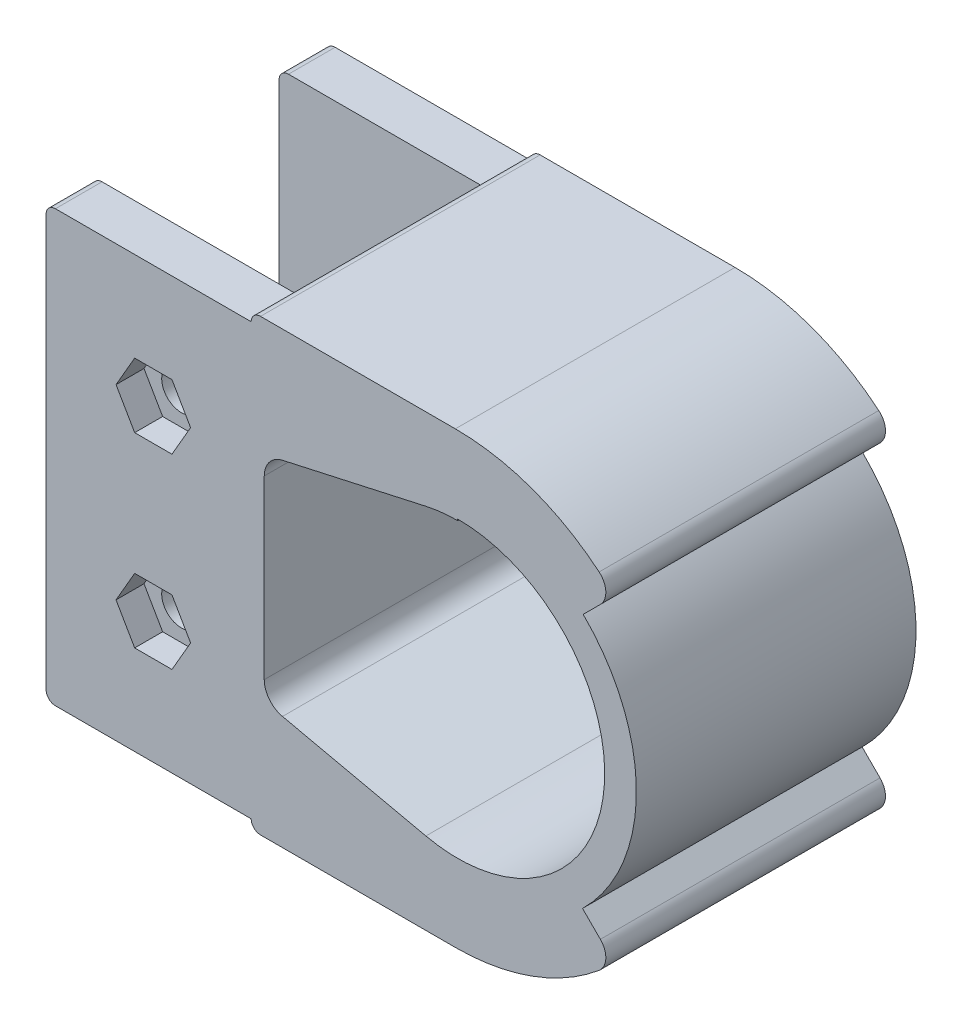
from build123d import *

# Parameters (mm, degrees)
EXTRUDE_1_DEPTH          = 30
EXTRUDE_START            = -30
EXTRUDE_2_DEPTH          = 30
EXTRUDE_3_DEPTH          = 30
EXTRUDE_START_2          = -2
SKETCH_9_W               = 5
SKETCH_9_H               = 46.18577558
EXTRUDE_6_DEPTH          = 22
FILLET_3_R               = 1
CUT_EXTRUDE_4_DEPTH      = 59.377928803
CUT_EXTRUDE_4_DEPTH_BACK = 59.377928803
SKETCH_10_R              = 2.1
CUT_EXTRUDE_5_DEPTH      = 3


with BuildPart() as part:
    # 草图1 → 凸台-拉伸1 (new body)
    with BuildSketch(Plane.XY):
        with BuildLine():
            Line((-23.903477417, 9.605041416), (-23.903477417, -9.460776308))
            ThreePointArc((-23.903477417, -9.460776308), (-22.605516257, -13.152827027), (-19.282718599, -15.22042404))
            Line((-19.282718599, -15.22042404), (-3.900036331, -18.636980321))
            ThreePointArc((-3.900036331, -18.636980321), (19.420354058, 0.072132554), (-3.900036331, 18.78124543))
            Line((-3.900036331, 18.78124543), (-19.282718599, 15.364689149))
            ThreePointArc((-19.282718599, 15.364689149), (-22.605516257, 13.297092136), (-23.903477417, 9.605041416))
        make_face()
        with BuildLine():
            ThreePointArc((-20.503477417, -9.460776308), (-19.953493875, -11.025204579), (-18.545528765, -11.901305008))
            Line((-18.545528765, -11.901305008), (-3.162846498, -15.317861289))
            ThreePointArc((-3.162846498, -15.317861289), (16.020354058, 0.072132554), (-3.162846498, 15.462126398))
            Line((-3.162846498, 15.462126398), (-18.545528765, 12.045570117))
            ThreePointArc((-18.545528765, 12.045570117), (-19.953493875, 11.169469687), (-20.503477417, 9.605041416))
            Line((-20.503477417, 9.605041416), (-20.503477417, -9.460776308))
        make_face(mode=Mode.SUBTRACT)
    extrude(amount=EXTRUDE_1_DEPTH)

    # 草图2 → 凸台-拉伸2 (add)
    with BuildSketch(Plane.XY.offset(30).offset(EXTRUDE_START)):
        with BuildLine():
            Line((0.255333714, -19.09288779), (-21.903477417, -19.09288779))
            ThreePointArc((-21.903477417, -19.09288779), (-23.31769098, -18.507101352), (-23.903477417, -17.09288779))
            Line((-23.903477417, -17.09288779), (-23.903477417, -9.460776308))
            Line((-23.903477417, -9.460776308), (-20.503477417, -9.460776308))
            ThreePointArc((-20.503477417, -9.460776308), (-19.953493875, -11.025204579), (-18.545528765, -11.901305008))
            Line((-18.545528765, -11.901305008), (-3.162846498, -15.317861289))
            ThreePointArc((-3.162846498, -15.317861289), (-1.464012153, -15.598850703), (0.255333714, -15.69288779))
            Line((0.255333714, -15.69288779), (0.255333714, -19.09288779))
        make_face()
    extrude_2 = extrude(amount=EXTRUDE_2_DEPTH)

    # 草图3 → 凸台-拉伸3 (add)
    with BuildSketch(Plane(origin=(0, 0, 0), x_dir=(-1, 0, 0), z_dir=(0, 0, -1))):
        with BuildLine():
            Line((21.903477417, -19.09288779), (21.903477417, -23.09288779))
            ThreePointArc((21.903477417, -23.09288779), (21.610584198, -23.799994571), (20.903477417, -24.09288779))
            Line((20.903477417, -24.09288779), (0, -24.09288779))
            ThreePointArc((0, -24.09288779), (-8.201928623, -22.653821067), (-15.42405585, -18.508531632))
            ThreePointArc((-15.42405585, -18.508531632), (-16.141619311, -17.062720423), (-15.557886921, -15.557886921))
            Line((-15.557886921, -15.557886921), (-13.642327271, -13.642327271))
            ThreePointArc((-13.642327271, -13.642327271), (-7.482369871, -17.678021056), (-0.255333714, -19.09288779))
            Line((-0.255333714, -19.09288779), (21.903477417, -19.09288779))
        make_face()
    extrude_3 = extrude(amount=-EXTRUDE_3_DEPTH)

    # 镜向1: 凸台-拉伸2, 凸台-拉伸3 across plane
    add(extrude_2.mirror(Plane.ZX))
    add(extrude_3.mirror(Plane.ZX))

    # 草图9 → 凸台-拉伸6 (add)
    with BuildSketch(Plane.ZY.offset(23.903477417).offset(EXTRUDE_START_2)):
        with Locations((2.5, 0)):
            Rectangle(SKETCH_9_W, SKETCH_9_H)
        with Locations((27.5, 0)):
            Rectangle(SKETCH_9_W, SKETCH_9_H)
    extrude(amount=EXTRUDE_6_DEPTH)

    # 圆角3
    fillet_3_edges = [part.edges().sort_by_distance(p)[0] for p in [
        (-43.903477417, 23.09288779, 27.5),
        (-43.903477417, -23.09288779, 27.5),
        (-43.903477417, 23.09288779, 2.5),
        (-43.903477417, -23.09288779, 2.5),
    ]]
    fillet(fillet_3_edges, radius=FILLET_3_R)

    # 草图10 → 切除-拉伸4 (cut, two sides: drawn at the far end of the back side and taken through both)
    with BuildSketch(Plane.XY.offset(30).offset(-CUT_EXTRUDE_4_DEPTH_BACK)):
        with Locations((-32.403477417, 10)):
            Circle(SKETCH_10_R)
        with Locations((-32.403477417, -10)):
            Circle(SKETCH_10_R)
    extrude(amount=CUT_EXTRUDE_4_DEPTH + CUT_EXTRUDE_4_DEPTH_BACK, mode=Mode.SUBTRACT)

    # 草图11 → 切除-拉伸5 (cut)
    with BuildSketch(Plane.XY.offset(30)):
        Polygon((-28.403477417, -10), (-30.403477417, -6.535898385), (-34.403477417, -6.535898385), (-36.403477417, -10), (-34.403477417, -13.464101615), (-30.403477417, -13.464101615), align=None)
        Polygon((-28.403477417, 10), (-30.403477417, 13.464101615), (-34.403477417, 13.464101615), (-36.403477417, 10), (-34.403477417, 6.535898385), (-30.403477417, 6.535898385), align=None)
    cut_extrude_5 = extrude(amount=-CUT_EXTRUDE_5_DEPTH, mode=Mode.SUBTRACT)

    # 镜向3: 切除-拉伸5 across plane
    add(cut_extrude_5.mirror(Plane.XY.offset(15)), mode=Mode.SUBTRACT)


solid = part.part
